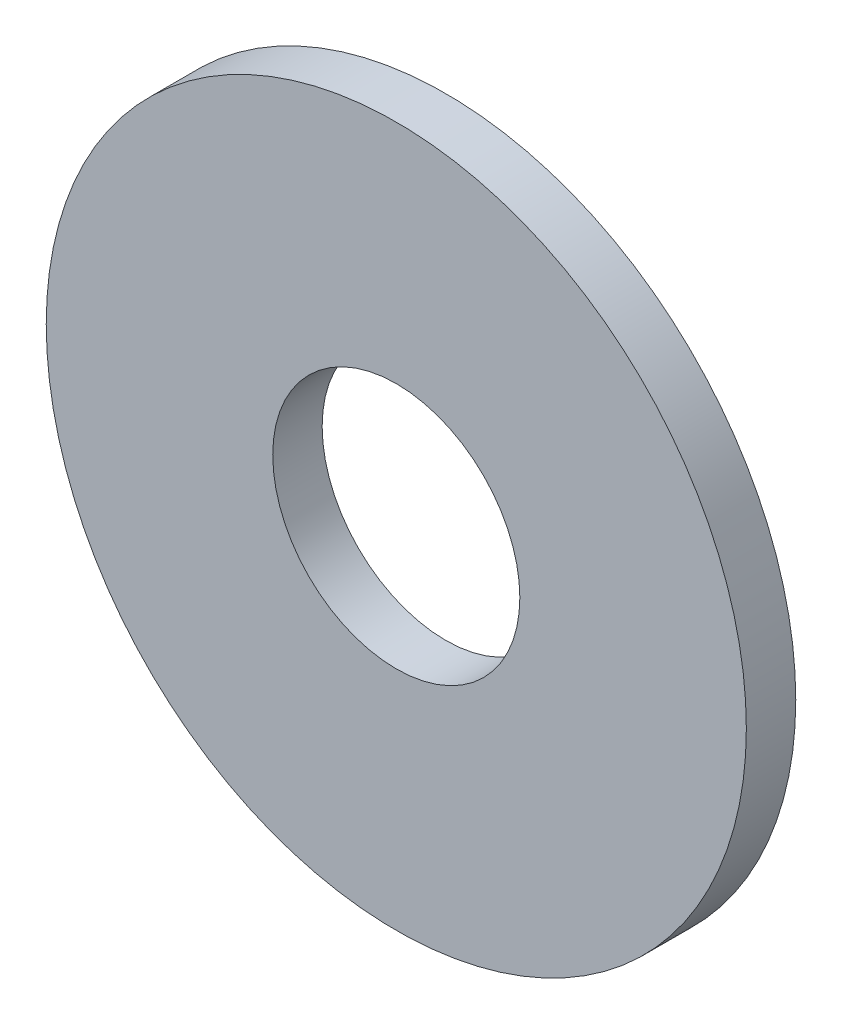
from build123d import *

# Parameters (mm, degrees)
SKETCH1_R           = 42.5
SKETCH1_R_2         = 15
BOSS_EXTRUDE1_DEPTH = 6


with BuildPart() as part:
    # Sketch1 → Boss-Extrude1 (new body)
    with BuildSketch(Plane.XY):
        Circle(SKETCH1_R)
        Circle(SKETCH1_R_2, mode=Mode.SUBTRACT)
    extrude(amount=BOSS_EXTRUDE1_DEPTH)


solid = part.part
